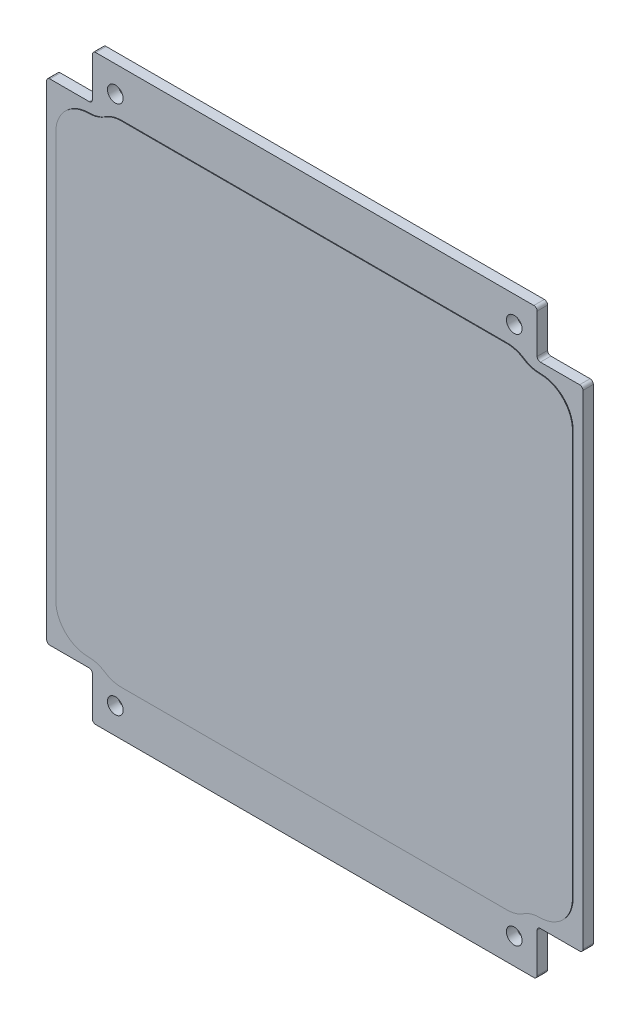
from build123d import *

# Parameters (mm, degrees)
BOSS_EXTRUDE1_DEPTH            = 1.6
BOSS_EXTRUDE2_DEPTH            = 0.1
M2_HOLE1_FIXINGSTRUCTURE_D     = 2.4
M2_HOLE1_FIXINGSTRUCTURE_DEPTH = 200
M2_HOLE1_FIXINGSTRUCTURE_TIP   = 0.721032743


with BuildPart() as part:
    # Sketch1 → Boss-Extrude1 (new body)
    with BuildSketch(Plane.XY):
        with BuildLine():
            Line((-34, 44), (-34, 38))
            ThreePointArc((-34, 38), (-34.146446609, 37.646446609), (-34.5, 37.5))
            Line((-34.5, 37.5), (-40.5, 37.5))
            ThreePointArc((-40.5, 37.5), (-40.853553391, 37.353553391), (-41, 37))
            Line((-41, 37), (-41, -37))
            ThreePointArc((-41, -37), (-40.853553391, -37.353553391), (-40.5, -37.5))
            Line((-40.5, -37.5), (-34.5, -37.5))
            ThreePointArc((-34.5, -37.5), (-34.146446609, -37.646446609), (-34, -38))
            Line((-34, -38), (-34, -44))
            ThreePointArc((-34, -44), (-33.853553391, -44.353553391), (-33.5, -44.5))
            Line((-33.5, -44.5), (33.5, -44.5))
            ThreePointArc((33.5, -44.5), (33.853553391, -44.353553391), (34, -44))
            Line((34, -44), (34, -38))
            ThreePointArc((34, -38), (34.146446609, -37.646446609), (34.5, -37.5))
            Line((34.5, -37.5), (40.5, -37.5))
            ThreePointArc((40.5, -37.5), (40.853553391, -37.353553391), (41, -37))
            Line((41, -37), (41, 37))
            ThreePointArc((41, 37), (40.853553391, 37.353553391), (40.5, 37.5))
            Line((40.5, 37.5), (34.5, 37.5))
            ThreePointArc((34.5, 37.5), (34.146446609, 37.646446609), (34, 38))
            Line((34, 38), (34, 44))
            ThreePointArc((34, 44), (33.853553391, 44.353553391), (33.5, 44.5))
            Line((33.5, 44.5), (-33.5, 44.5))
            ThreePointArc((-33.5, 44.5), (-33.853553391, 44.353553391), (-34, 44))
        make_face()
    extrude(amount=BOSS_EXTRUDE1_DEPTH)

    # Esboço1 → Boss-Extrude2 (add)
    with BuildSketch(Plane.XY.offset(1.6)):
        with BuildLine():
            Line((-29.5, -37.5), (29.5, -37.5))
            ThreePointArc((29.5, -37.5), (30.805038314, -37.308461045), (32, -36.75))
            ThreePointArc((32, -36.75), (33.194961686, -36.191538955), (34.5, -36))
            ThreePointArc((34.5, -36), (38.035533906, -34.535533906), (39.5, -31))
            Line((39.5, -31), (39.5, 31))
            ThreePointArc((39.5, 31), (38.035533906, 34.535533906), (34.5, 36))
            ThreePointArc((34.5, 36), (33.194961686, 36.191538955), (32, 36.75))
            ThreePointArc((32, 36.75), (30.805038314, 37.308461045), (29.5, 37.5))
            Line((29.5, 37.5), (-29.5, 37.5))
            ThreePointArc((-29.5, 37.5), (-30.805038314, 37.308461045), (-32, 36.75))
            ThreePointArc((-32, 36.75), (-33.194961686, 36.191538955), (-34.5, 36))
            ThreePointArc((-34.5, 36), (-38.035533906, 34.535533906), (-39.5, 31))
            Line((-39.5, 31), (-39.5, -31))
            ThreePointArc((-39.5, -31), (-38.035533906, -34.535533906), (-34.5, -36))
            ThreePointArc((-34.5, -36), (-33.194961686, -36.191538955), (-32, -36.75))
            ThreePointArc((-32, -36.75), (-30.805038314, -37.308461045), (-29.5, -37.5))
        make_face()
    extrude(amount=BOSS_EXTRUDE2_DEPTH)

    # M2 Hole1-FixingStructure
    with Locations(Plane(origin=(0, 0, 0), x_dir=(-1, 0, 0), z_dir=(0, 0, -1))):
        with Locations((-30.5, 40.5), (30.5, 40.5), (-30.5, -40.5), (30.5, -40.5)):
            Hole(M2_HOLE1_FIXINGSTRUCTURE_D / 2, depth=M2_HOLE1_FIXINGSTRUCTURE_DEPTH)
            with Locations((0, 0, -(M2_HOLE1_FIXINGSTRUCTURE_DEPTH + M2_HOLE1_FIXINGSTRUCTURE_TIP / 2))):  # 118° drill point
                Cone(0, M2_HOLE1_FIXINGSTRUCTURE_D / 2, M2_HOLE1_FIXINGSTRUCTURE_TIP, mode=Mode.SUBTRACT)


solid = part.part
